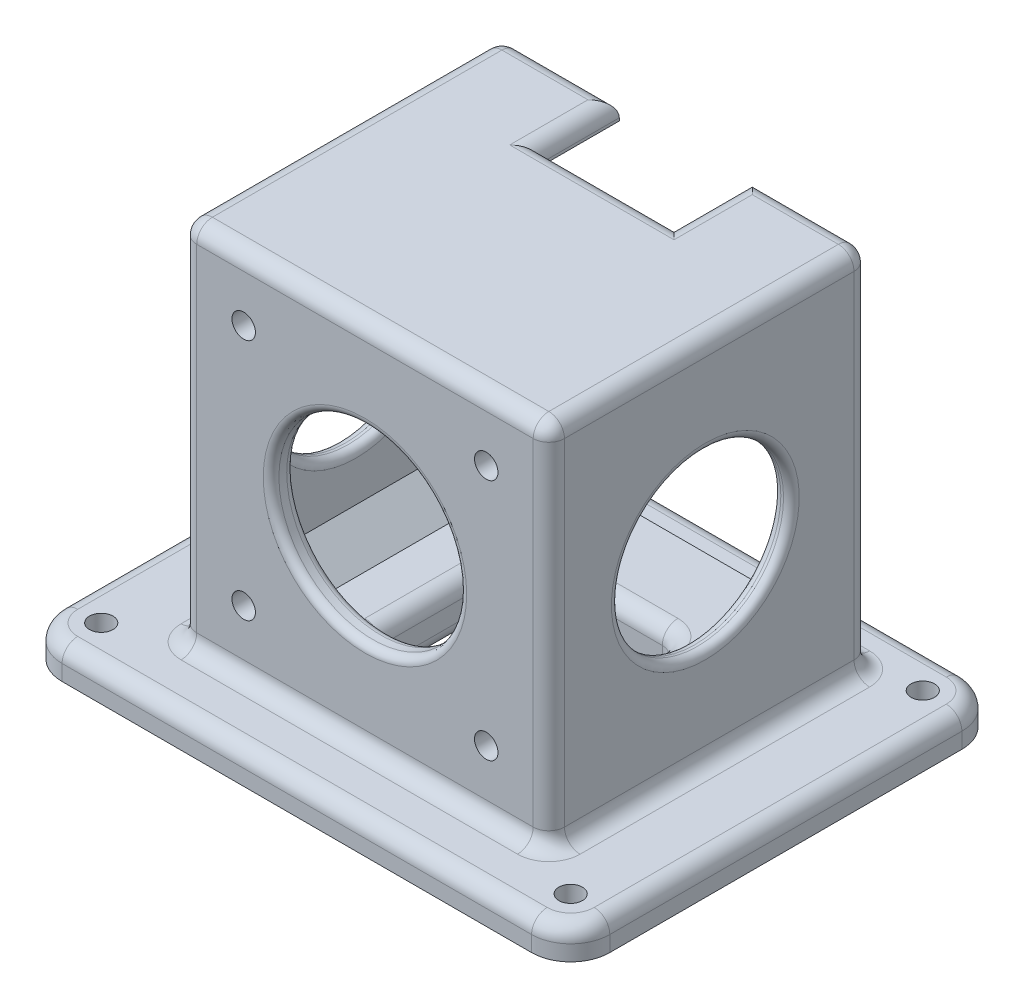
from build123d import *

# Parameters (mm, degrees)
SKETCH_1_W          = 47
SKETCH_1_H          = 47
EXTRUDE_3_DEPTH     = 41
SKETCH_1_5_W        = 42.3
SKETCH_1_5_H        = 42.3
CUT_EXTRUDE_2_DEPTH = 38
CHAMFER_2_SIZE      = 4
SKETCH_2_W          = 17
SKETCH_2_H          = 10
CUT_EXTRUDE_3_DEPTH = 10
SKETCH_3_R          = 12
SKETCH_3_R_2        = 1.5
CUT_EXTRUDE_4_DEPTH = 10
SKETCH_4_W          = 70
SKETCH_4_H          = 55
SKETCH_4_R          = 1.5
EXTRUDE_4_DEPTH     = 4
FILLET_4_R          = 5
FILLET_5_R          = 2
SKETCH_5_R          = 11
CUT_EXTRUDE_5_DEPTH = 47
SKETCH_7_W          = 20
SKETCH_7_H          = 20
CUT_EXTRUDE_6_DEPTH = 47
FILLET_6_R          = 2
FILLET_7_R          = 1
FILLET_8_R          = 1


with BuildPart() as part:
    # 草图1 → 凸台-拉伸3 (new body)
    with BuildSketch(Plane.XY):
        Rectangle(SKETCH_1_W, SKETCH_1_H)
    extrude(amount=EXTRUDE_3_DEPTH)

    # 草图1<5> → 切除-拉伸2 (cut)
    with BuildSketch(Plane.XY):
        Rectangle(SKETCH_1_5_W, SKETCH_1_5_H)
    extrude(amount=CUT_EXTRUDE_2_DEPTH, mode=Mode.SUBTRACT)

    # 倒角2
    chamfer_2_edges = [part.edges().sort_by_distance(p)[0] for p in [
        (21.15, -21.15, 19),
        (-21.15, 21.15, 19),
        (-21.15, -21.15, 19),
        (21.15, 21.15, 19),
    ]]
    chamfer(chamfer_2_edges, length=CHAMFER_2_SIZE)

    # 草图2 → 切除-拉伸3 (cut)
    with BuildSketch(Plane(origin=(0, 23.5, 0), x_dir=(1, 0, 0), z_dir=(0, 1, 0))):
        with Locations((0, -5)):
            Rectangle(SKETCH_2_W, SKETCH_2_H)
    extrude(amount=-CUT_EXTRUDE_3_DEPTH, mode=Mode.SUBTRACT)

    # 草图3 → 切除-拉伸4 (cut)
    with BuildSketch(Plane.XY.offset(41)):
        Circle(SKETCH_3_R)
        with Locations((-15.5, 15.5)):
            Circle(SKETCH_3_R_2)
        with Locations((15.5, 15.5)):
            Circle(SKETCH_3_R_2)
        with Locations((-15.5, -15.5)):
            Circle(SKETCH_3_R_2)
        with Locations((15.5, -15.5)):
            Circle(SKETCH_3_R_2)
    extrude(amount=-CUT_EXTRUDE_4_DEPTH, mode=Mode.SUBTRACT)

    # 草图4 → 凸台-拉伸4 (add)
    with BuildSketch(Plane.XZ.offset(23.5)):
        with Locations((-0.70843805, 21.5)):
            Rectangle(SKETCH_4_W, SKETCH_4_H)
        with Locations((-30.70843805, 44)):
            Circle(SKETCH_4_R, mode=Mode.SUBTRACT)
        with Locations((29.29156195, 44)):
            Circle(SKETCH_4_R, mode=Mode.SUBTRACT)
        with Locations((29.29156195, -1)):
            Circle(SKETCH_4_R, mode=Mode.SUBTRACT)
        with Locations((-30.70843805, -1)):
            Circle(SKETCH_4_R, mode=Mode.SUBTRACT)
    extrude(amount=EXTRUDE_4_DEPTH)

    # 圆角4
    fillet_4_edges = [part.edges().sort_by_distance(p)[0] for p in [
        (34.29156195, -25.5, 49),
        (-35.70843805, -25.5, 49),
        (-35.70843805, -25.5, -6),
        (34.29156195, -25.5, -6),
    ]]
    fillet(fillet_4_edges, radius=FILLET_4_R)

    # 圆角5
    fillet_5_edges = [part.edges().sort_by_distance(p)[0] for p in [
        (0, -23.5, 41),
        (0, -23.5, 0),
        (0, 23.5, 10),
        (8.5, 23.5, 5),
        (16, 23.5, 0),
        (0, 23.5, 41),
        (-16, 23.5, 0),
        (-8.5, 23.5, 5),
        (-34.243971956, -23.5, 47.535533906),
        (-35.70843805, -23.5, 21.5),
        (-34.243971956, -23.5, -4.535533906),
        (-0.70843805, -23.5, -6),
        (32.827095856, -23.5, -4.535533906),
        (34.29156195, -23.5, 21.5),
        (32.827095856, -23.5, 47.535533906),
        (-0.70843805, -23.5, 49),
        (-23.5, 23.5, 20.5),
        (-23.5, 0, 41),
        (-23.5, -23.5, 20.5),
        (-23.5, 0, 0),
        (23.5, -23.5, 20.5),
        (23.5, 0, 41),
        (23.5, 23.5, 20.5),
        (23.5, 0, 0),
    ]]
    fillet(fillet_5_edges, radius=FILLET_5_R)

    # 草图5 → 切除-拉伸5 (cut)
    with BuildSketch(Plane.ZY.offset(23.5)):
        with Locations((21, 0)):
            Circle(SKETCH_5_R)
    extrude(amount=-CUT_EXTRUDE_5_DEPTH, mode=Mode.SUBTRACT)

    # 草图7 → 切除-拉伸6 (cut)
    with BuildSketch(Plane(origin=(0, -21.15, 0), x_dir=(1, 0, 0), z_dir=(0, 1, 0))):
        with Locations((0, -21)):
            Rectangle(SKETCH_7_W, SKETCH_7_H)
    extrude(amount=-CUT_EXTRUDE_6_DEPTH, mode=Mode.SUBTRACT)

    # 圆角6
    fillet_6_edges = [part.edges().sort_by_distance(p)[0] for p in [
        (10, -27.5, 21),
        (10, -21.15, 21),
        (-10, -21.15, 21),
        (-10, -27.5, 21),
        (-10, -24.325, 11),
        (0, -21.15, 11),
        (10, -24.325, 11),
        (0, -27.5, 11),
        (10, -24.325, 31),
        (0, -21.15, 31),
        (-10, -24.325, 31),
        (0, -27.5, 31),
    ]]
    fillet(fillet_6_edges, radius=FILLET_6_R)

    # 圆角7
    fillet_7_edges = [part.edges().sort_by_distance(p)[0] for p in [
        (21.15, 0, 10),
        (23.5, 0, 10),
        (-23.5, 0, 10),
        (-21.15, 0, 10),
    ]]
    fillet(fillet_7_edges, radius=FILLET_7_R)

    # 圆角8
    fillet_8_edges = [part.edges().sort_by_distance(p)[0] for p in [
        (-12, 0, 41),
        (-12, 0, 38),
    ]]
    fillet(fillet_8_edges, radius=FILLET_8_R)


solid = part.part
